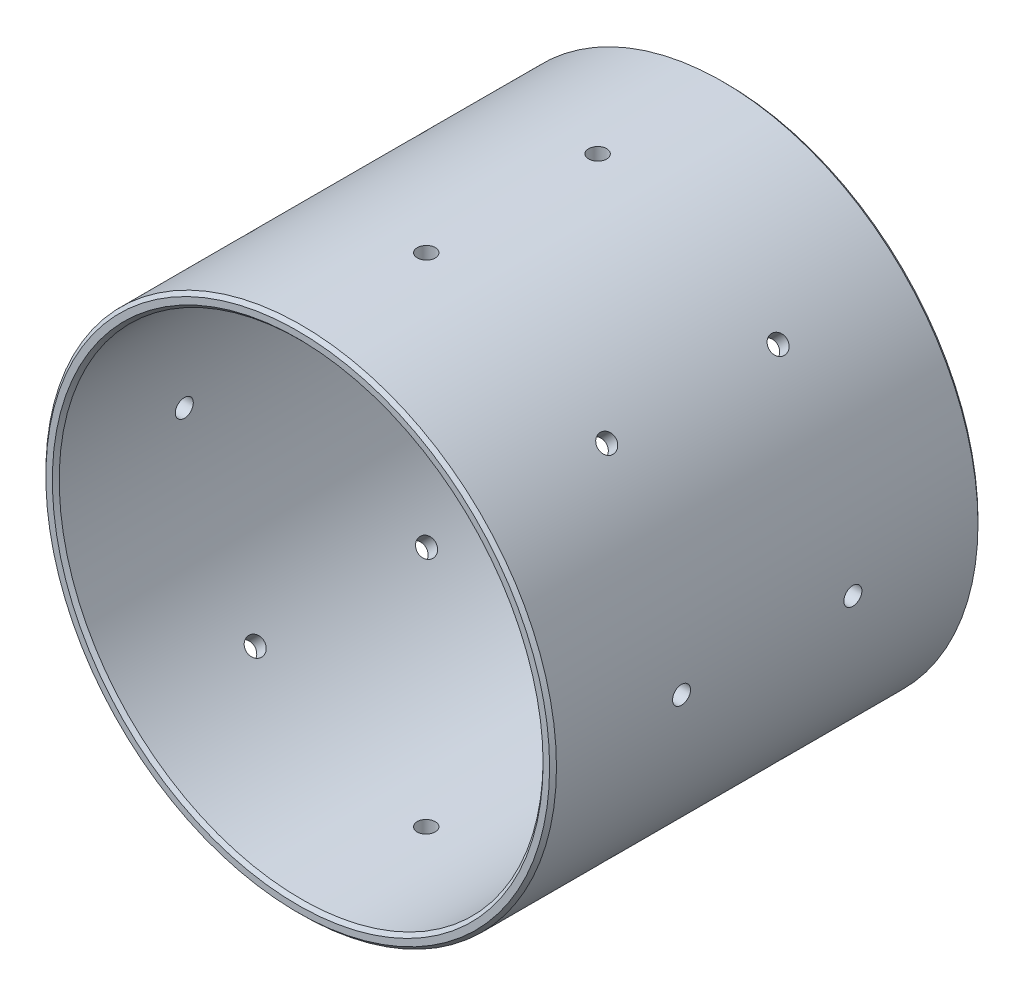
from build123d import *

# Parameters (mm, degrees)
SKETCH1_R           = 29.8
SKETCH1_R_2         = 28.24
EXTRUDE_THIN1_DEPTH = 50
CHAMFER1_SIZE       = 0.4
SKETCH2_R           = 1.05
CUT_EXTRUDE1_DEPTH  = 66.391742598
CIRPATTERN1_COUNT   = 4
CIRPATTERN1_ANGLE   = 135


with BuildPart() as part:
    # Sketch1 → Extrude-Thin1 (new body)
    with BuildSketch(Plane(origin=(0, 0, 0), x_dir=(0, 1, 0), z_dir=(0, 0, 1))):
        Circle(SKETCH1_R)
        Circle(SKETCH1_R_2, mode=Mode.SUBTRACT)
    extrude(amount=EXTRUDE_THIN1_DEPTH)

    # Chamfer1
    chamfer1_edges = [part.edges().sort_by_distance(p)[0] for p in [
        (0, -29.8, 0),
        (0, -28.24, 0),
        (0, -29.8, 50),
        (0, -28.24, 50),
    ]]
    chamfer(chamfer1_edges, length=CHAMFER1_SIZE)

    # Sketch2 → Cut-Extrude1 (cut, symmetric)
    with BuildSketch(Plane(origin=(0, 0, 0), x_dir=(-1, 0, 0), z_dir=(0, 1, 0))):
        with Locations(Location((0, 35, 0), (0, 0, 90))):
            Circle(SKETCH2_R)
        with Locations(Location((0, 15, 0), (0, 0, 90))):
            Circle(SKETCH2_R)
    cut_extrude1 = extrude(amount=CUT_EXTRUDE1_DEPTH, both=True, mode=Mode.SUBTRACT)

    # CirPattern1: Cut-Extrude1 ×4 about axis
    cirpattern1_axis = Axis((0, 0, 50), (0, 0, -1))
    for i in range(1, CIRPATTERN1_COUNT):
        add(cut_extrude1.rotate(cirpattern1_axis, i * CIRPATTERN1_ANGLE / (CIRPATTERN1_COUNT - 1)), mode=Mode.SUBTRACT)


solid = part.part
